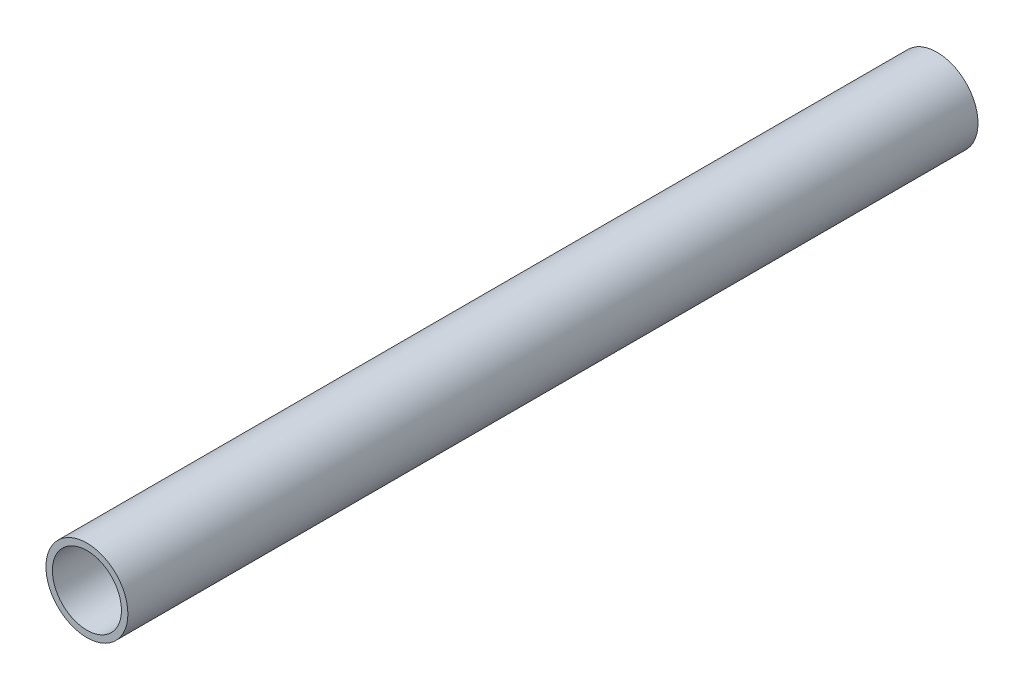
from build123d import *

# Parameters (mm, degrees)
SKETCH1_R           = 44.5
SKETCH1_R_2         = 37.5
BOSS_EXTRUDE1_DEPTH = 461.5


with BuildPart() as part:
    # Sketch1 → Boss-Extrude1 (new, symmetric)
    with BuildSketch(Plane.XY):
        Circle(SKETCH1_R)
        Circle(SKETCH1_R_2, mode=Mode.SUBTRACT)
    extrude(amount=BOSS_EXTRUDE1_DEPTH, both=True)


solid = part.part
